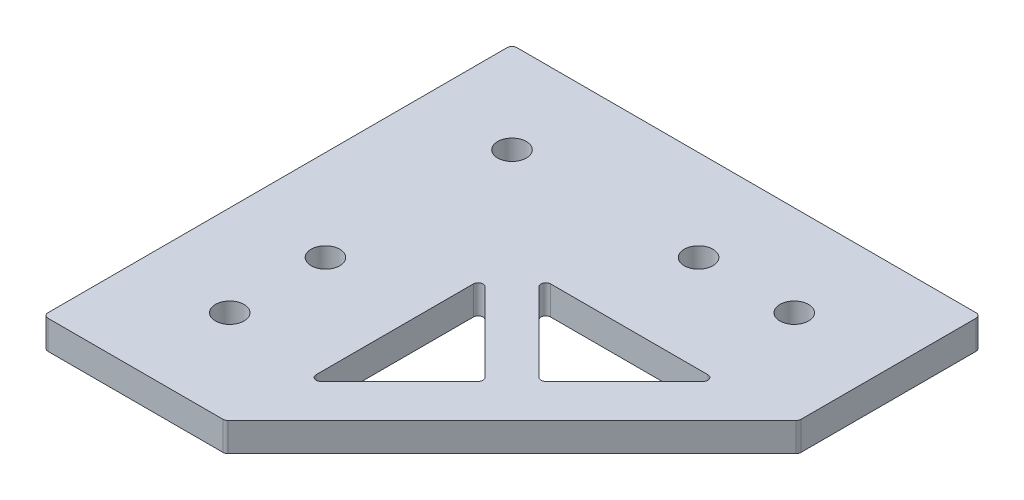
from build123d import *

# Parameters (mm, degrees)
SKETCH1_R           = 1.5
BOSS_EXTRUDE1_DEPTH = 3
FILLET1_R           = 0.5
CUT_EXTRUDE1_DEPTH  = 3


with BuildPart() as part:
    # Sketch1 → Boss-Extrude1 (new body)
    with BuildSketch(Plane(origin=(0, 0, 0), x_dir=(1, 0, 0), z_dir=(0, 1, 0))):
        Polygon((0, 0), (49, 0), (49, -19), (19, -49), (0, -49), (0, -19), align=None)
        with Locations(Location((9.5, -9.5, 0), (0, 0, 270))):
            Circle(SKETCH1_R, mode=Mode.SUBTRACT)
        with Locations(Location((39, -9.5, 0), (0, 0, 270))):
            Circle(SKETCH1_R, mode=Mode.SUBTRACT)
        with Locations(Location((9.5, -39, 0), (0, 0, 270))):
            Circle(SKETCH1_R, mode=Mode.SUBTRACT)
        with Locations(Location((9.5, -29, 0), (0, 0, 270))):
            Circle(SKETCH1_R, mode=Mode.SUBTRACT)
        with Locations(Location((29, -9.5, 0), (0, 0, 270))):
            Circle(SKETCH1_R, mode=Mode.SUBTRACT)
    extrude(amount=BOSS_EXTRUDE1_DEPTH)

    # Fillet1
    fillet1_edges = [part.edges().sort_by_distance(p)[0] for p in [
        (0, 1.5, 0),
        (49, 1.5, 0),
        (49, 1.5, 19),
        (19, 1.5, 49),
        (0, 1.5, 49),
    ]]
    fillet(fillet1_edges, radius=FILLET1_R)

    # Sketch2 → Cut-Extrude1 (cut)
    with BuildSketch(Plane(origin=(0, 3, 0), x_dir=(1, 0, 0), z_dir=(0, 1, 0))):
        with BuildLine():
            Line((23.658427125, -19.622893219), (40.098932188, -19.622893219))
            ThreePointArc((40.098932188, -19.622893219), (40.560871954, -19.931551503), (40.452485579, -20.476446609))
            Line((40.452485579, -20.476446609), (32.232233047, -28.696699141))
            ThreePointArc((32.232233047, -28.696699141), (31.878679656, -28.843145751), (31.525126266, -28.696699141))
            Line((31.525126266, -28.696699141), (23.304873734, -20.476446609))
            ThreePointArc((23.304873734, -20.476446609), (23.196487358, -19.931551503), (23.658427125, -19.622893219))
        make_face()
        with BuildLine():
            Line((20.476446609, -23.304873734), (28.696699141, -31.525126266))
            ThreePointArc((28.696699141, -31.525126266), (28.843145751, -31.878679656), (28.696699141, -32.232233047))
            Line((28.696699141, -32.232233047), (20.476446609, -40.452485579))
            ThreePointArc((20.476446609, -40.452485579), (19.931551503, -40.560871954), (19.622893219, -40.098932188))
            Line((19.622893219, -40.098932188), (19.622893219, -23.658427125))
            ThreePointArc((19.622893219, -23.658427125), (19.931551503, -23.196487358), (20.476446609, -23.304873734))
        make_face()
    extrude(amount=-CUT_EXTRUDE1_DEPTH, mode=Mode.SUBTRACT)


solid = part.part
